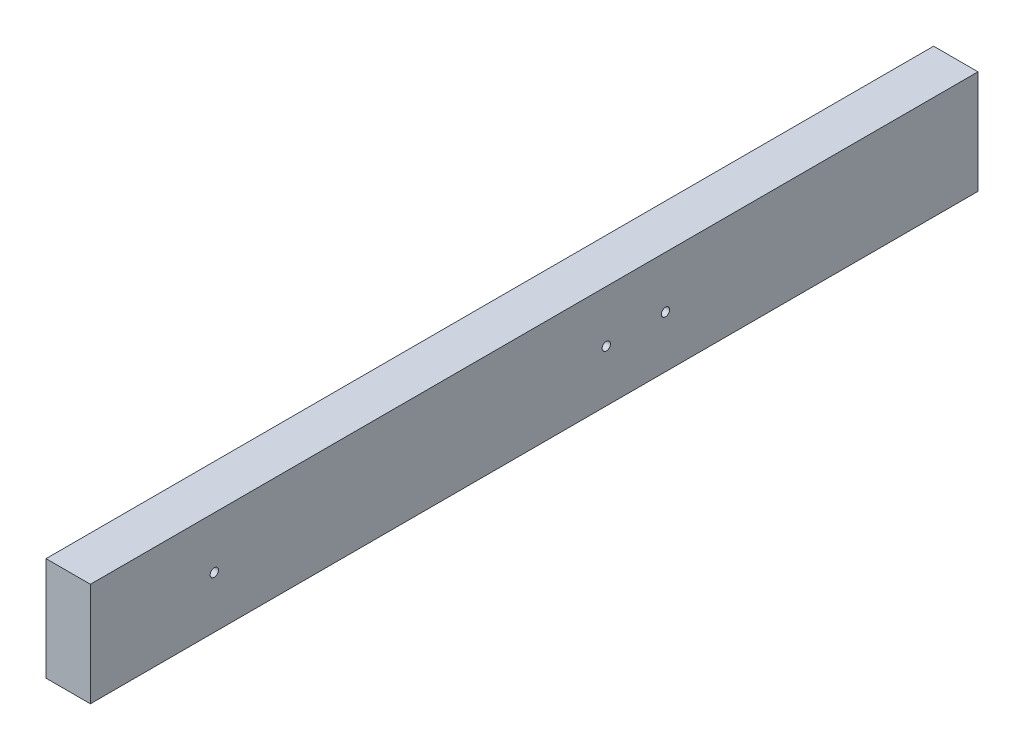
from build123d import *

# Parameters (mm, degrees)
SKETCH1_W           = 762
SKETCH1_H           = 88.9
BOSS_EXTRUDE1_DEPTH = 38.1
SKETCH2_R           = 3.571875
CUT_EXTRUDE1_DEPTH  = 769.113806672


with BuildPart() as part:
    # Sketch1 → Boss-Extrude1 (new body)
    with BuildSketch(Plane(origin=(0, 0, 0), x_dir=(0, 0, -1), z_dir=(1, 0, 0))):
        with Locations((381, 44.45)):
            Rectangle(SKETCH1_W, SKETCH1_H)
    extrude(amount=BOSS_EXTRUDE1_DEPTH)

    # Sketch2 → Cut-Extrude1 (cut, through all)
    with BuildSketch(Plane(origin=(38.1, 0, 0), x_dir=(0, 0, -1), z_dir=(1, 0, 0))):
        with Locations((106.39298, 44.45)):
            Circle(SKETCH2_R)
        with Locations((442.9125, 44.45)):
            Circle(SKETCH2_R)
        with Locations((493.7125, 44.45)):
            Circle(SKETCH2_R)
    extrude(amount=-CUT_EXTRUDE1_DEPTH, mode=Mode.SUBTRACT)


solid = part.part
